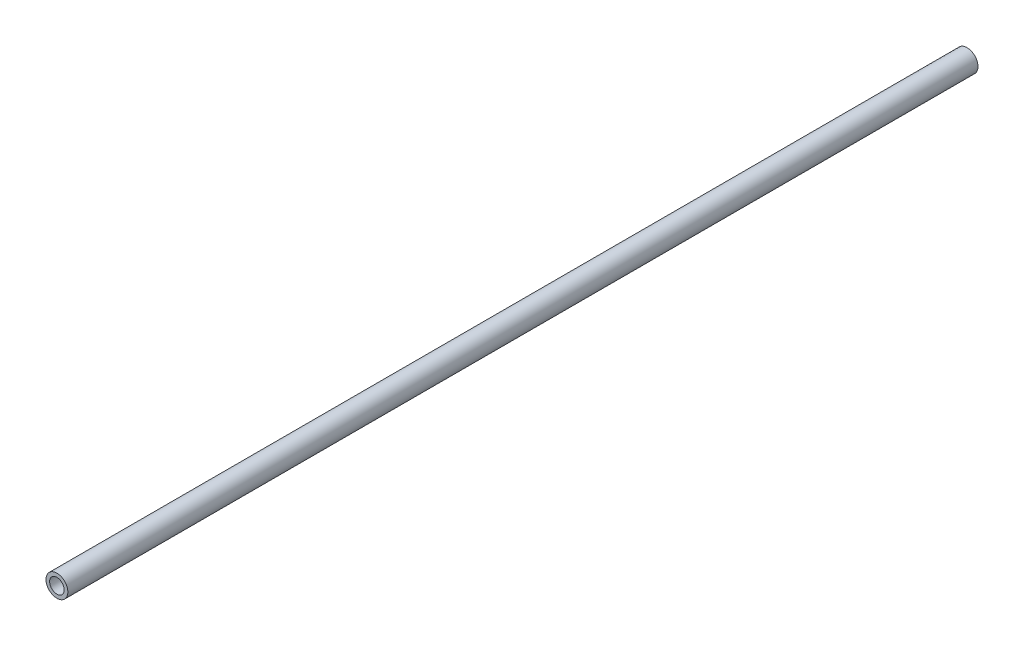
from build123d import *

# Parameters (mm, degrees)
SKETCH1_R           = 3
SKETCH1_R_2         = 2
BOSS_EXTRUDE1_DEPTH = 250


with BuildPart() as part:
    # Sketch1 → Boss-Extrude1 (new body)
    with BuildSketch(Plane.XY):
        Circle(SKETCH1_R)
        Circle(SKETCH1_R_2, mode=Mode.SUBTRACT)
    extrude(amount=BOSS_EXTRUDE1_DEPTH)


solid = part.part
